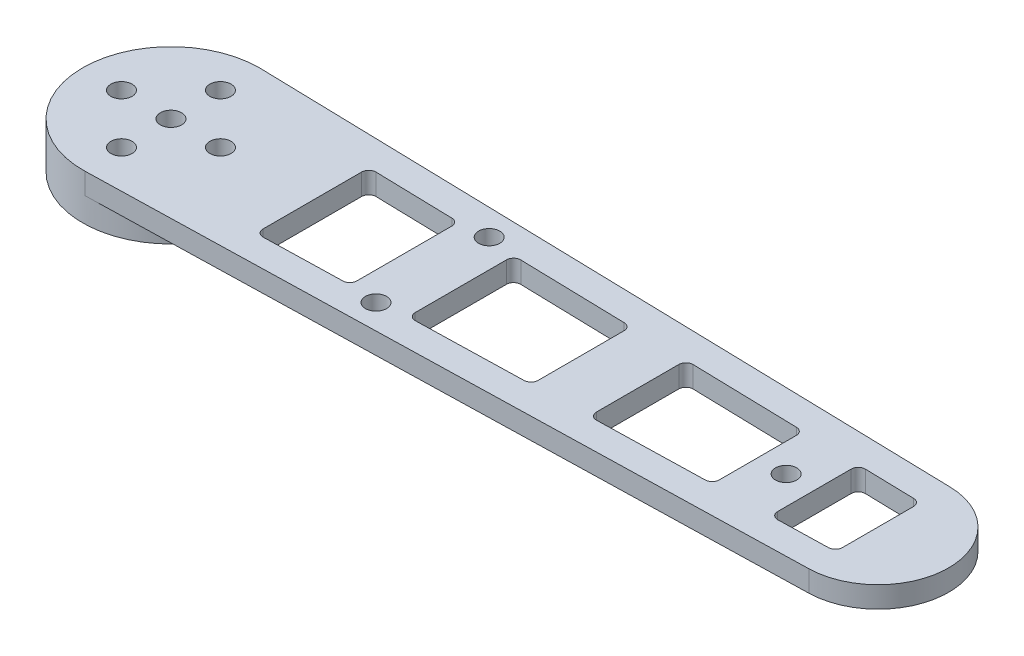
from build123d import *
from build123d.topology import SkipClean

# Parameters (mm, degrees)
SKETCH_1_R          = 1.5
EXTRUDE_1_DEPTH     = 3
EXTRUDE_START       = 3.5
SKETCH_2_R          = 12.5
SKETCH_2_R_2        = 10
EXTRUDE_2_DEPTH     = 3.5
CUT_EXTRUDE_1_DEPTH = 10
FILLET_1_R          = 1
EXTRUDE_START_2     = 1
SKETCH_5_R          = 10
SKETCH_5_R_2        = 1.5
EXTRUDE_3_DEPTH     = 1


with BuildPart() as part:
    # 草图1 → 凸台-拉伸1 (new body)
    with BuildSketch(Plane(origin=(0, 0, 0), x_dir=(1, 0, 0), z_dir=(0, 1, 0))):
        with BuildLine():
            Line((100.25, 9.996874512), (0.3125, 12.496093139))
            ThreePointArc((0.3125, 12.496093139), (-12.5, 0), (0.3125, -12.496093139))
            Line((0.3125, -12.496093139), (100.25, -9.996874512))
            ThreePointArc((100.25, -9.996874512), (110, 0), (100.25, 9.996874512))
        make_face()
        with Locations(Location((7, 0, 0), (0, 0, 270))):
            Circle(SKETCH_1_R, mode=Mode.SUBTRACT)
        with Locations(Location((0, 0, 0), (0, 0, 270))):
            Circle(SKETCH_1_R, mode=Mode.SUBTRACT)
        with Locations(Location((-7, 0, 0), (0, 0, 270))):
            Circle(SKETCH_1_R, mode=Mode.SUBTRACT)
        with Locations(Location((0, 7, 0), (0, 0, 270))):
            Circle(SKETCH_1_R, mode=Mode.SUBTRACT)
        with Locations(Location((0, -7, 0), (0, 0, 270))):
            Circle(SKETCH_1_R, mode=Mode.SUBTRACT)
    extrude(amount=EXTRUDE_1_DEPTH)

    # 草图2 → 凸台-拉伸2 (add)
    with BuildSketch(Plane.XZ.offset(EXTRUDE_START)):
        with Locations(Location((0, 0, 0), (0, 0, 270))):
            Circle(SKETCH_2_R)
        with Locations(Location((0, 0, 0), (0, 0, 270))):
            Circle(SKETCH_2_R_2, mode=Mode.SUBTRACT)
    extrude(amount=-EXTRUDE_2_DEPTH)

    # 草图3 → 切除-拉伸1 (cut)
    with BuildSketch(Plane(origin=(0, 3, 0), x_dir=(1, 0, 0), z_dir=(0, 1, 0))):
        Polygon((20, 8.002501172), (20, 0), (33, 0), (33, 7.677399562), align=None)
        Polygon((33, 0), (20, 0), (20, -8.002501172), (33, -7.677399562), align=None)
        with BuildLine():
            ThreePointArc((38.5, 8), (36.805156295, 9.487291475), (35.550618759, 7.613614157))
            Line((35.550618759, 7.613614157), (38.42825626, 7.541650728))
            ThreePointArc((38.42825626, 7.541650728), (38.481955531, 7.768034906), (38.5, 8))
        make_face()
        with BuildLine():
            Line((38.42825626, 7.541650728), (35.550618759, 7.613614157))
            ThreePointArc((35.550618759, 7.613614157), (36.9625, 6.500468823), (38.42825626, 7.541650728))
        make_face()
        with BuildLine():
            ThreePointArc((38.42825626, -7.541650728), (36.9625, -6.500468823), (35.550618759, -7.613614157))
            Line((35.550618759, -7.613614157), (38.42825626, -7.541650728))
        make_face()
        with BuildLine():
            Line((38.42825626, -7.541650728), (35.550618759, -7.613614157))
            ThreePointArc((35.550618759, -7.613614157), (36.805156295, -9.487291475), (38.5, -8))
            ThreePointArc((38.5, -8), (38.481955531, -7.768034906), (38.42825626, -7.541650728))
        make_face()
        Polygon((41, 7.477337033), (41, 0), (58, 0), (58, 7.052204158), align=None)
        Polygon((58, 0), (41, 0), (41, -7.477337033), (58, -7.052204158), align=None)
        Polygon((66, 6.852141629), (66, 0), (83, 0), (83, 6.427008754), align=None)
        Polygon((83, 0), (66, 0), (66, -6.852141629), (83, -6.427008754), align=None)
        with BuildLine():
            ThreePointArc((88.5, 0), (87, 1.5), (85.5, 0))
            Line((85.5, 0), (88.5, 0))
        make_face()
        with BuildLine():
            Line((88.5, 0), (85.5, 0))
            ThreePointArc((85.5, 0), (87, -1.5), (88.5, 0))
        make_face()
        Polygon((95.393745853, 6.117068236), (91, 6.226946225), (91, 0), (100, 0), (100, 6.001875879), align=None)
        Polygon((91, 0), (91, -6.226946225), (100, -6.001875879), (100, 0), align=None)
    extrude(amount=-CUT_EXTRUDE_1_DEPTH, mode=Mode.SUBTRACT)

    # 圆角1
    fillet_1_edges = [part.edges().sort_by_distance(p)[0] for p in [
        (91, 1.5, 6.226946225),
        (91, 1.5, -6.226946225),
        (100, 1.5, -6.001875879),
        (100, 1.5, 6.001875879),
        (20, 1.5, 8.002501172),
        (20, 1.5, -8.002501172),
        (33, 1.5, -7.677399562),
        (33, 1.5, 7.677399562),
        (41, 1.5, 7.477337033),
        (41, 1.5, -7.477337033),
        (58, 1.5, -7.052204158),
        (58, 1.5, 7.052204158),
        (66, 1.5, 6.852141629),
        (66, 1.5, -6.852141629),
        (83, 1.5, -6.427008754),
        (83, 1.5, 6.427008754),
    ]]
    fillet(fillet_1_edges, radius=FILLET_1_R)

    # 草图5 → 凸台-拉伸3 (add)
    with SkipClean():  # the faces are left unmerged after this step: merging them gives an invalid solid
        with BuildSketch(Plane.XZ.offset(EXTRUDE_START_2)):
            with Locations(Location((0, 0, 0), (0, 0, 270))):
                Circle(SKETCH_5_R)
            with Locations(Location((0, 0, 0), (0, 0, 270))):
                Circle(SKETCH_5_R_2, mode=Mode.SUBTRACT)
            with Locations(Location((7, 0, 0), (0, 0, 270))):
                Circle(SKETCH_5_R_2, mode=Mode.SUBTRACT)
            with Locations(Location((-7, 0, 0), (0, 0, 270))):
                Circle(SKETCH_5_R_2, mode=Mode.SUBTRACT)
            with Locations(Location((0, -7, 0), (0, 0, 270))):
                Circle(SKETCH_5_R_2, mode=Mode.SUBTRACT)
            with Locations(Location((0, 7, 0), (0, 0, 270))):
                Circle(SKETCH_5_R_2, mode=Mode.SUBTRACT)
        extrude(amount=-EXTRUDE_3_DEPTH)


solid = part.part
